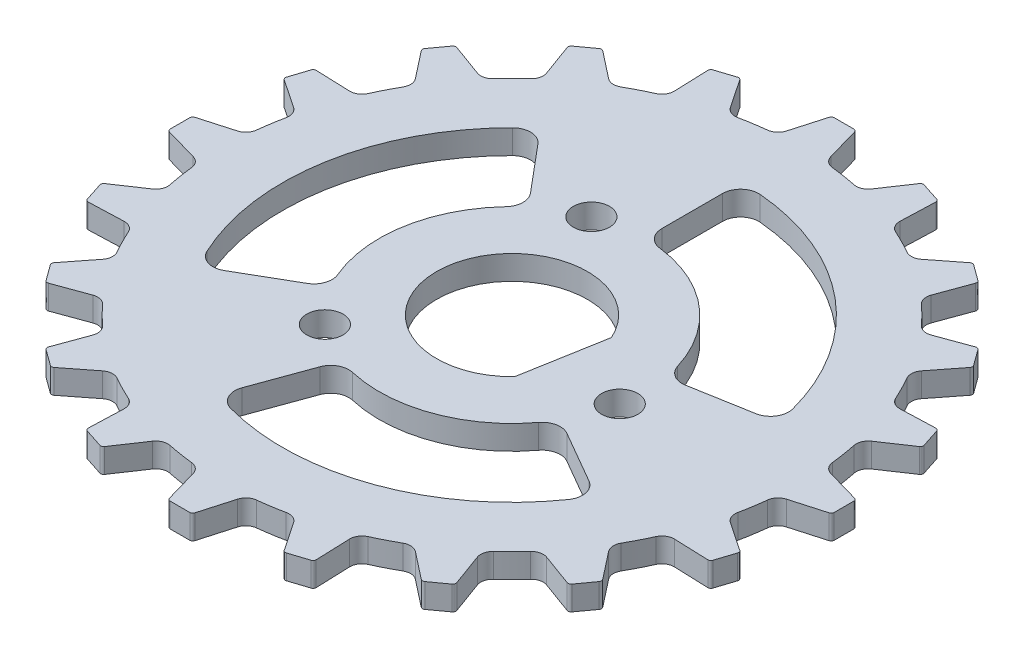
from build123d import *

# Parameters (mm, degrees)
SKETCH_1_R      = 1.5
EXTRUDE_1_DEPTH = 2
FILLET_1_R      = 1.5


with BuildPart() as part:
    # 草图1 → 凸台-拉伸1 (new body)
    with BuildSketch(Plane(origin=(0, 0, 0), x_dir=(1, 0, 0), z_dir=(0, 1, 0))):
        with BuildLine():
            Line((-0.811424647, 27.5), (0.811424647, 27.5))
            ThreePointArc((0.811424647, 27.5), (0.961973525, 27.449587162), (1.051805634, 27.318680282))
            Line((1.051805634, 27.318680282), (1.837693654, 24.56807221))
            ThreePointArc((1.837693654, 24.56807221), (2.153204064, 24.079467386), (2.687248898, 23.849081604))
            ThreePointArc((2.687248898, 23.849081604), (3.754427161, 23.704520174), (4.814045941, 23.512230045))
            ThreePointArc((4.814045941, 23.512230045), (5.393145882, 23.566311014), (5.844201307, 23.933503738))
            Line((5.844201307, 23.933503738), (7.441609869, 26.306634714))
            ThreePointArc((7.441609869, 26.306634714), (7.567497732, 26.403374907), (7.726256647, 26.404798204))
            Line((7.726256647, 26.404798204), (9.269678043, 25.903310193))
            ThreePointArc((9.269678043, 25.903310193), (9.397280111, 25.808842573), (9.442263073, 25.656583083))
            Line((9.442263073, 25.656583083), (9.339702357, 22.797746598))
            ThreePointArc((9.339702357, 22.797746598), (9.488783394, 22.235557718), (9.925497091, 21.85141889))
            ThreePointArc((9.925497091, 21.85141889), (10.895771994, 21.384156581), (11.844108421, 20.873837589))
            ThreePointArc((11.844108421, 20.873837589), (12.411577132, 20.746319925), (12.954025125, 20.956157165))
            Line((12.954025125, 20.956157165), (15.206588749, 22.719512452))
            ThreePointArc((15.206588749, 22.719512452), (15.356209585, 22.772616354), (15.507638109, 22.724910786))
            Line((15.507638109, 22.724910786), (16.820550767, 21.771023905))
            ThreePointArc((16.820550767, 21.771023905), (16.912715445, 21.641748652), (16.908446014, 21.483040772))
            Line((16.908446014, 21.483040772), (15.927475919, 18.795818708))
            ThreePointArc((15.927475919, 18.795818708), (15.895534493, 18.215076736), (16.192168474, 17.714787047))
            ThreePointArc((16.192168474, 17.714787047), (16.970562748, 16.970562748), (17.714787047, 16.192168474))
            ThreePointArc((17.714787047, 16.192168474), (18.215076736, 15.895534493), (18.795818708, 15.927475919))
            Line((18.795818708, 15.927475919), (21.483040772, 16.908446014))
            ThreePointArc((21.483040772, 16.908446014), (21.641748652, 16.912715445), (21.771023905, 16.820550767))
            Line((21.771023905, 16.820550767), (22.724910786, 15.507638109))
            ThreePointArc((22.724910786, 15.507638109), (22.772616354, 15.356209585), (22.719512452, 15.206588749))
            Line((22.719512452, 15.206588749), (20.956157165, 12.954025125))
            ThreePointArc((20.956157165, 12.954025125), (20.746319925, 12.411577132), (20.873837589, 11.844108421))
            ThreePointArc((20.873837589, 11.844108421), (21.384156581, 10.895771994), (21.85141889, 9.925497091))
            ThreePointArc((21.85141889, 9.925497091), (22.235557718, 9.488783394), (22.797746598, 9.339702357))
            Line((22.797746598, 9.339702357), (25.656583083, 9.442263073))
            ThreePointArc((25.656583083, 9.442263073), (25.808842573, 9.397280111), (25.903310193, 9.269678043))
            Line((25.903310193, 9.269678043), (26.404798204, 7.726256647))
            ThreePointArc((26.404798204, 7.726256647), (26.403374907, 7.567497732), (26.306634714, 7.441609869))
            Line((26.306634714, 7.441609869), (23.933503738, 5.844201307))
            ThreePointArc((23.933503738, 5.844201307), (23.566311014, 5.393145882), (23.512230045, 4.814045941))
            ThreePointArc((23.512230045, 4.814045941), (23.704520174, 3.754427161), (23.849081604, 2.687248898))
            ThreePointArc((23.849081604, 2.687248898), (24.079467386, 2.153204064), (24.56807221, 1.837693654))
            Line((24.56807221, 1.837693654), (27.318680282, 1.051805634))
            ThreePointArc((27.318680282, 1.051805634), (27.449587162, 0.961973525), (27.5, 0.811424647))
            Line((27.5, 0.811424647), (27.5, -0.811424647))
            ThreePointArc((27.5, -0.811424647), (27.449587162, -0.961973525), (27.318680282, -1.051805634))
            Line((27.318680282, -1.051805634), (24.56807221, -1.837693654))
            ThreePointArc((24.56807221, -1.837693654), (24.079467386, -2.153204064), (23.849081604, -2.687248898))
            ThreePointArc((23.849081604, -2.687248898), (23.704520174, -3.754427161), (23.512230045, -4.814045941))
            ThreePointArc((23.512230045, -4.814045941), (23.566311014, -5.393145882), (23.933503738, -5.844201307))
            Line((23.933503738, -5.844201307), (26.306634714, -7.441609869))
            ThreePointArc((26.306634714, -7.441609869), (26.403374907, -7.567497732), (26.404798204, -7.726256647))
            Line((26.404798204, -7.726256647), (25.903310193, -9.269678043))
            ThreePointArc((25.903310193, -9.269678043), (25.808842573, -9.397280111), (25.656583083, -9.442263073))
            Line((25.656583083, -9.442263073), (22.797746598, -9.339702357))
            ThreePointArc((22.797746598, -9.339702357), (22.235557718, -9.488783394), (21.85141889, -9.925497091))
            ThreePointArc((21.85141889, -9.925497091), (21.384156581, -10.895771994), (20.873837589, -11.844108421))
            ThreePointArc((20.873837589, -11.844108421), (20.746319925, -12.411577132), (20.956157165, -12.954025125))
            Line((20.956157165, -12.954025125), (22.719512452, -15.206588749))
            ThreePointArc((22.719512452, -15.206588749), (22.772616354, -15.356209585), (22.724910786, -15.507638109))
            Line((22.724910786, -15.507638109), (21.771023905, -16.820550767))
            ThreePointArc((21.771023905, -16.820550767), (21.641748652, -16.912715445), (21.483040772, -16.908446014))
            Line((21.483040772, -16.908446014), (18.795818708, -15.927475919))
            ThreePointArc((18.795818708, -15.927475919), (18.215076736, -15.895534493), (17.714787047, -16.192168474))
            ThreePointArc((17.714787047, -16.192168474), (16.970562748, -16.970562748), (16.192168474, -17.714787047))
            ThreePointArc((16.192168474, -17.714787047), (15.895534493, -18.215076736), (15.927475919, -18.795818708))
            Line((15.927475919, -18.795818708), (16.908446014, -21.483040772))
            ThreePointArc((16.908446014, -21.483040772), (16.912715445, -21.641748652), (16.820550767, -21.771023905))
            Line((16.820550767, -21.771023905), (15.507638109, -22.724910786))
            ThreePointArc((15.507638109, -22.724910786), (15.356209585, -22.772616354), (15.206588749, -22.719512452))
            Line((15.206588749, -22.719512452), (12.954025125, -20.956157165))
            ThreePointArc((12.954025125, -20.956157165), (12.411577132, -20.746319925), (11.844108421, -20.873837589))
            ThreePointArc((11.844108421, -20.873837589), (10.895771994, -21.384156581), (9.925497091, -21.85141889))
            ThreePointArc((9.925497091, -21.85141889), (9.488783394, -22.235557718), (9.339702357, -22.797746598))
            Line((9.339702357, -22.797746598), (9.442263073, -25.656583083))
            ThreePointArc((9.442263073, -25.656583083), (9.397280111, -25.808842573), (9.269678043, -25.903310193))
            Line((9.269678043, -25.903310193), (7.726256647, -26.404798204))
            ThreePointArc((7.726256647, -26.404798204), (7.567497732, -26.403374907), (7.441609869, -26.306634714))
            Line((7.441609869, -26.306634714), (5.844201307, -23.933503738))
            ThreePointArc((5.844201307, -23.933503738), (5.393145882, -23.566311014), (4.814045941, -23.512230045))
            ThreePointArc((4.814045941, -23.512230045), (3.754427161, -23.704520174), (2.687248898, -23.849081604))
            ThreePointArc((2.687248898, -23.849081604), (2.153204064, -24.079467386), (1.837693654, -24.56807221))
            Line((1.837693654, -24.56807221), (1.051805634, -27.318680282))
            ThreePointArc((1.051805634, -27.318680282), (0.961973525, -27.449587162), (0.811424647, -27.5))
            Line((0.811424647, -27.5), (-0.811424647, -27.5))
            ThreePointArc((-0.811424647, -27.5), (-0.961973525, -27.449587162), (-1.051805634, -27.318680282))
            Line((-1.051805634, -27.318680282), (-1.837693654, -24.56807221))
            ThreePointArc((-1.837693654, -24.56807221), (-2.153204064, -24.079467386), (-2.687248898, -23.849081604))
            ThreePointArc((-2.687248898, -23.849081604), (-3.754427161, -23.704520174), (-4.814045941, -23.512230045))
            ThreePointArc((-4.814045941, -23.512230045), (-5.393145882, -23.566311014), (-5.844201307, -23.933503738))
            Line((-5.844201307, -23.933503738), (-7.441609869, -26.306634714))
            ThreePointArc((-7.441609869, -26.306634714), (-7.567497732, -26.403374907), (-7.726256647, -26.404798204))
            Line((-7.726256647, -26.404798204), (-9.269678043, -25.903310193))
            ThreePointArc((-9.269678043, -25.903310193), (-9.397280111, -25.808842573), (-9.442263073, -25.656583083))
            Line((-9.442263073, -25.656583083), (-9.339702357, -22.797746598))
            ThreePointArc((-9.339702357, -22.797746598), (-9.488783394, -22.235557718), (-9.925497091, -21.85141889))
            ThreePointArc((-9.925497091, -21.85141889), (-10.895771994, -21.384156581), (-11.844108421, -20.873837589))
            ThreePointArc((-11.844108421, -20.873837589), (-12.411577132, -20.746319925), (-12.954025125, -20.956157165))
            Line((-12.954025125, -20.956157165), (-15.206588749, -22.719512452))
            ThreePointArc((-15.206588749, -22.719512452), (-15.356209585, -22.772616354), (-15.507638109, -22.724910786))
            Line((-15.507638109, -22.724910786), (-16.820550767, -21.771023905))
            ThreePointArc((-16.820550767, -21.771023905), (-16.912715445, -21.641748652), (-16.908446014, -21.483040772))
            Line((-16.908446014, -21.483040772), (-15.927475919, -18.795818708))
            ThreePointArc((-15.927475919, -18.795818708), (-15.895534493, -18.215076736), (-16.192168474, -17.714787047))
            ThreePointArc((-16.192168474, -17.714787047), (-16.970562748, -16.970562748), (-17.714787047, -16.192168474))
            ThreePointArc((-17.714787047, -16.192168474), (-18.215076736, -15.895534493), (-18.795818708, -15.927475919))
            Line((-18.795818708, -15.927475919), (-21.483040772, -16.908446014))
            ThreePointArc((-21.483040772, -16.908446014), (-21.641748652, -16.912715445), (-21.771023905, -16.820550767))
            Line((-21.771023905, -16.820550767), (-22.724910786, -15.507638109))
            ThreePointArc((-22.724910786, -15.507638109), (-22.772616354, -15.356209585), (-22.719512452, -15.206588749))
            Line((-22.719512452, -15.206588749), (-20.956157165, -12.954025125))
            ThreePointArc((-20.956157165, -12.954025125), (-20.746319925, -12.411577132), (-20.873837589, -11.844108421))
            ThreePointArc((-20.873837589, -11.844108421), (-21.384156581, -10.895771994), (-21.85141889, -9.925497091))
            ThreePointArc((-21.85141889, -9.925497091), (-22.235557718, -9.488783394), (-22.797746598, -9.339702357))
            Line((-22.797746598, -9.339702357), (-25.656583083, -9.442263073))
            ThreePointArc((-25.656583083, -9.442263073), (-25.808842573, -9.397280111), (-25.903310193, -9.269678043))
            Line((-25.903310193, -9.269678043), (-26.404798204, -7.726256647))
            ThreePointArc((-26.404798204, -7.726256647), (-26.403374907, -7.567497732), (-26.306634714, -7.441609869))
            Line((-26.306634714, -7.441609869), (-23.933503738, -5.844201307))
            ThreePointArc((-23.933503738, -5.844201307), (-23.566311014, -5.393145882), (-23.512230045, -4.814045941))
            ThreePointArc((-23.512230045, -4.814045941), (-23.704520174, -3.754427161), (-23.849081604, -2.687248898))
            ThreePointArc((-23.849081604, -2.687248898), (-24.079467386, -2.153204064), (-24.56807221, -1.837693654))
            Line((-24.56807221, -1.837693654), (-27.318680282, -1.051805634))
            ThreePointArc((-27.318680282, -1.051805634), (-27.449587162, -0.961973525), (-27.5, -0.811424647))
            Line((-27.5, -0.811424647), (-27.5, 0.811424647))
            ThreePointArc((-27.5, 0.811424647), (-27.449587162, 0.961973525), (-27.318680282, 1.051805634))
            Line((-27.318680282, 1.051805634), (-24.56807221, 1.837693654))
            ThreePointArc((-24.56807221, 1.837693654), (-24.079467386, 2.153204064), (-23.849081604, 2.687248898))
            ThreePointArc((-23.849081604, 2.687248898), (-23.704520174, 3.754427161), (-23.512230045, 4.814045941))
            ThreePointArc((-23.512230045, 4.814045941), (-23.566311014, 5.393145882), (-23.933503738, 5.844201307))
            Line((-23.933503738, 5.844201307), (-26.306634714, 7.441609869))
            ThreePointArc((-26.306634714, 7.441609869), (-26.403374907, 7.567497732), (-26.404798204, 7.726256647))
            Line((-26.404798204, 7.726256647), (-25.903310193, 9.269678043))
            ThreePointArc((-25.903310193, 9.269678043), (-25.808842573, 9.397280111), (-25.656583083, 9.442263073))
            Line((-25.656583083, 9.442263073), (-22.797746598, 9.339702357))
            ThreePointArc((-22.797746598, 9.339702357), (-22.235557718, 9.488783394), (-21.85141889, 9.925497091))
            ThreePointArc((-21.85141889, 9.925497091), (-21.384156581, 10.895771994), (-20.873837589, 11.844108421))
            ThreePointArc((-20.873837589, 11.844108421), (-20.746319925, 12.411577132), (-20.956157165, 12.954025125))
            Line((-20.956157165, 12.954025125), (-22.719512452, 15.206588749))
            ThreePointArc((-22.719512452, 15.206588749), (-22.772616354, 15.356209585), (-22.724910786, 15.507638109))
            Line((-22.724910786, 15.507638109), (-21.771023905, 16.820550767))
            ThreePointArc((-21.771023905, 16.820550767), (-21.641748652, 16.912715445), (-21.483040772, 16.908446014))
            Line((-21.483040772, 16.908446014), (-18.795818708, 15.927475919))
            ThreePointArc((-18.795818708, 15.927475919), (-18.215076736, 15.895534493), (-17.714787047, 16.192168474))
            ThreePointArc((-17.714787047, 16.192168474), (-16.970562748, 16.970562748), (-16.192168474, 17.714787047))
            ThreePointArc((-16.192168474, 17.714787047), (-15.895534493, 18.215076736), (-15.927475919, 18.795818708))
            Line((-15.927475919, 18.795818708), (-16.908446014, 21.483040772))
            ThreePointArc((-16.908446014, 21.483040772), (-16.912715445, 21.641748652), (-16.820550767, 21.771023905))
            Line((-16.820550767, 21.771023905), (-15.507638109, 22.724910786))
            ThreePointArc((-15.507638109, 22.724910786), (-15.356209585, 22.772616354), (-15.206588749, 22.719512452))
            Line((-15.206588749, 22.719512452), (-12.954025125, 20.956157165))
            ThreePointArc((-12.954025125, 20.956157165), (-12.411577132, 20.746319925), (-11.844108421, 20.873837589))
            ThreePointArc((-11.844108421, 20.873837589), (-10.895771994, 21.384156581), (-9.925497091, 21.85141889))
            ThreePointArc((-9.925497091, 21.85141889), (-9.488783394, 22.235557718), (-9.339702357, 22.797746598))
            Line((-9.339702357, 22.797746598), (-9.442263073, 25.656583083))
            ThreePointArc((-9.442263073, 25.656583083), (-9.397280111, 25.808842573), (-9.269678043, 25.903310193))
            Line((-9.269678043, 25.903310193), (-7.726256647, 26.404798204))
            ThreePointArc((-7.726256647, 26.404798204), (-7.567497732, 26.403374907), (-7.441609869, 26.306634714))
            Line((-7.441609869, 26.306634714), (-5.844201307, 23.933503738))
            ThreePointArc((-5.844201307, 23.933503738), (-5.393145882, 23.566311014), (-4.814045941, 23.512230045))
            ThreePointArc((-4.814045941, 23.512230045), (-3.754427161, 23.704520174), (-2.687248898, 23.849081604))
            ThreePointArc((-2.687248898, 23.849081604), (-2.153204064, 24.079467386), (-1.837693654, 24.56807221))
            Line((-1.837693654, 24.56807221), (-1.051805634, 27.318680282))
            ThreePointArc((-1.051805634, 27.318680282), (-0.961973525, 27.449587162), (-0.811424647, 27.5))
        make_face()
        with Locations(Location((-3.762221577, 10.336618829, 0), (0, 0, 270))):
            Circle(SKETCH_1_R, mode=Mode.SUBTRACT)
        with Locations(Location((10.832885283, -1.910129954, 0), (0, 0, 270))):
            Circle(SKETCH_1_R, mode=Mode.SUBTRACT)
        with Locations(Location((-7.070663707, -8.426488874, 0), (0, 0, 270))):
            Circle(SKETCH_1_R, mode=Mode.SUBTRACT)
        with BuildLine():
            Line((0, 19), (0, 11))
            ThreePointArc((0, 11), (7.070663707, 8.426488874), (10.832885283, 1.910129954))
            Line((10.832885283, 1.910129954), (18.711347307, 3.299315376))
            ThreePointArc((18.711347307, 3.299315376), (12.212964584, 14.554844419), (0, 19))
        make_face(mode=Mode.SUBTRACT)
        with BuildLine():
            Line((16.454482672, -9.5), (9.526279442, -5.5))
            ThreePointArc((9.526279442, -5.5), (3.762221577, -10.336618829), (-3.762221577, -10.336618829))
            Line((-3.762221577, -10.336618829), (-6.498382723, -17.854159795))
            ThreePointArc((-6.498382723, -17.854159795), (6.498382723, -17.854159795), (16.454482672, -9.5))
        make_face(mode=Mode.SUBTRACT)
        with BuildLine():
            Line((-16.454482672, -9.5), (-9.526279442, -5.5))
            ThreePointArc((-9.526279442, -5.5), (-10.832885283, 1.910129954), (-7.070663707, 8.426488874))
            Line((-7.070663707, 8.426488874), (-12.212964584, 14.554844419))
            ThreePointArc((-12.212964584, 14.554844419), (-18.711347307, 3.299315376), (-16.454482672, -9.5))
        make_face(mode=Mode.SUBTRACT)
        with BuildLine():
            Line((5.129207047, -0.904417592), (5.729129808, 2.497913457))
            ThreePointArc((5.729129808, 2.497913457), (-6.155048456, 1.08530111), (4.529284286, -4.306748641))
            Line((4.529284286, -4.306748641), (5.129207047, -0.904417592))
        make_face(mode=Mode.SUBTRACT)
    extrude(amount=EXTRUDE_1_DEPTH)

    # 圆角1
    fillet_1_edges = [part.edges().sort_by_distance(p)[0] for p in [
        (18.711347307, 1, -3.299315376),
        (0, 1, -19),
        (0, 1, -11),
        (10.832885283, 1, -1.910129954),
        (-6.498382723, 1, 17.854159795),
        (16.454482672, 1, 9.5),
        (9.526279442, 1, 5.5),
        (-3.762221577, 1, 10.336618829),
        (-12.212964584, 1, -14.554844419),
        (-16.454482672, 1, 9.5),
        (-9.526279442, 1, 5.5),
        (-7.070663707, 1, -8.426488874),
    ]]
    fillet(fillet_1_edges, radius=FILLET_1_R)


solid = part.part
